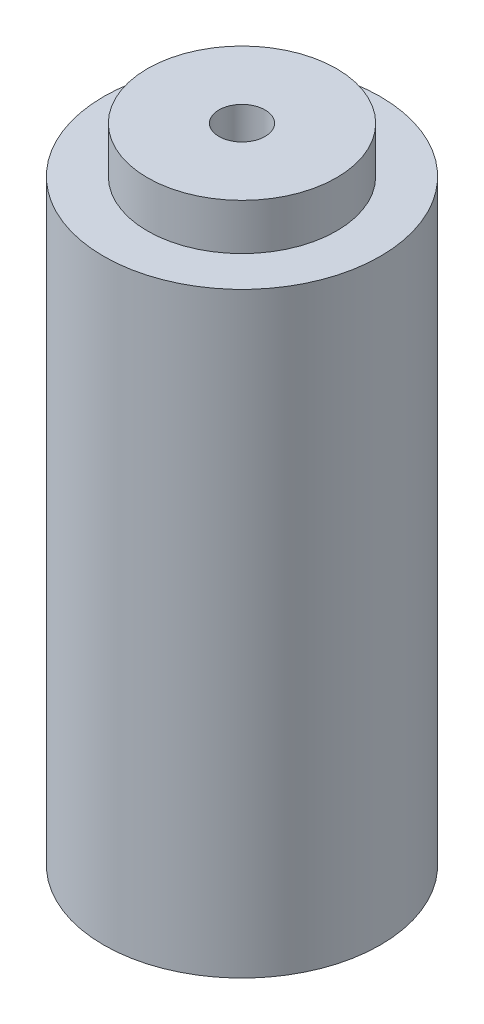
from build123d import *

# Parameters (mm, degrees)
ESBO_O1_R                = 9
ESBO_O1_R_2              = 6.15
RESSALTO_EXTRUS_O1_DEPTH = 38.8
ESBO_O1_2_R              = 6.15
RESSALTO_EXTRUS_O2_DEPTH = 41.8
ESBO_O2_R                = 1.5
CORTE_EXTRUS_O1_DEPTH    = 44.694850955


with BuildPart() as part:
    # Esboço1 → Ressalto-extrusão1 (new body)
    with BuildSketch(Plane(origin=(0, 0, 0), x_dir=(1, 0, 0), z_dir=(0, 1, 0))):
        Circle(ESBO_O1_R)
        Circle(ESBO_O1_R_2, mode=Mode.SUBTRACT)
    extrude(amount=RESSALTO_EXTRUS_O1_DEPTH)

    # Esboço1<2> → Ressalto-extrusão2 (add)
    with BuildSketch(Plane(origin=(0, 0, 0), x_dir=(1, 0, 0), z_dir=(0, 1, 0))):
        Circle(ESBO_O1_2_R)
    extrude(amount=RESSALTO_EXTRUS_O2_DEPTH)

    # Esboço2 → Corte-extrusão1 (cut, through all)
    with BuildSketch(Plane(origin=(0, 41.8, 0), x_dir=(1, 0, 0), z_dir=(0, 1, 0))):
        Circle(ESBO_O2_R)
    extrude(amount=-CORTE_EXTRUS_O1_DEPTH, mode=Mode.SUBTRACT)


solid = part.part
